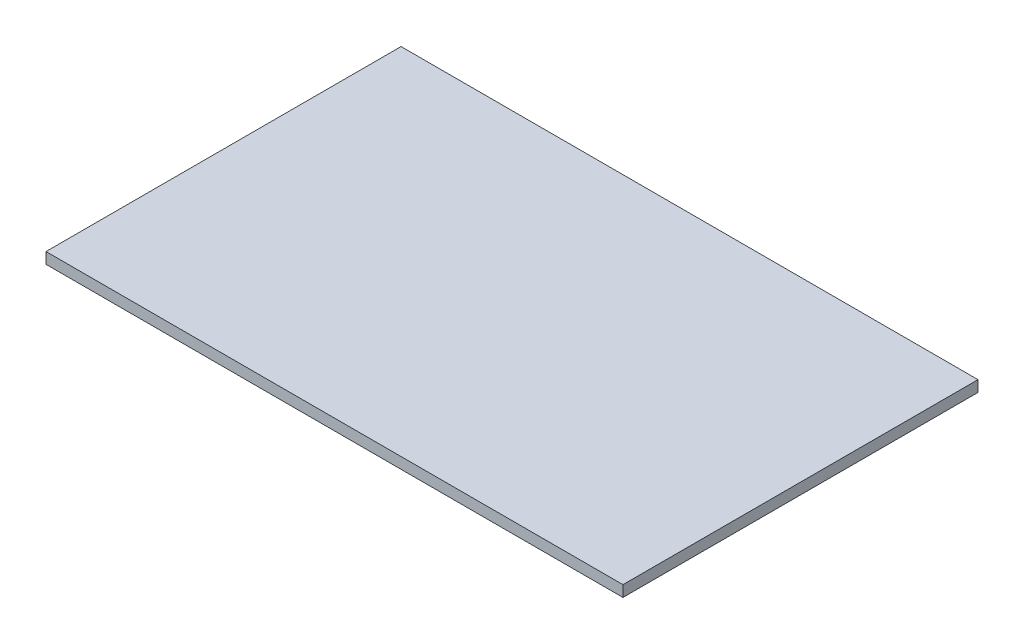
from build123d import *

# Parameters (mm, degrees)
SKETCH_1_W      = 104
SKETCH_1_H      = 64
EXTRUDE_1_DEPTH = 2


with BuildPart() as part:
    # 草图1 → 凸台-拉伸1 (new body)
    with BuildSketch(Plane(origin=(0, 0, 0), x_dir=(1, 0, 0), z_dir=(0, 1, 0))):
        Rectangle(SKETCH_1_W, SKETCH_1_H)
    extrude(amount=EXTRUDE_1_DEPTH)


solid = part.part
